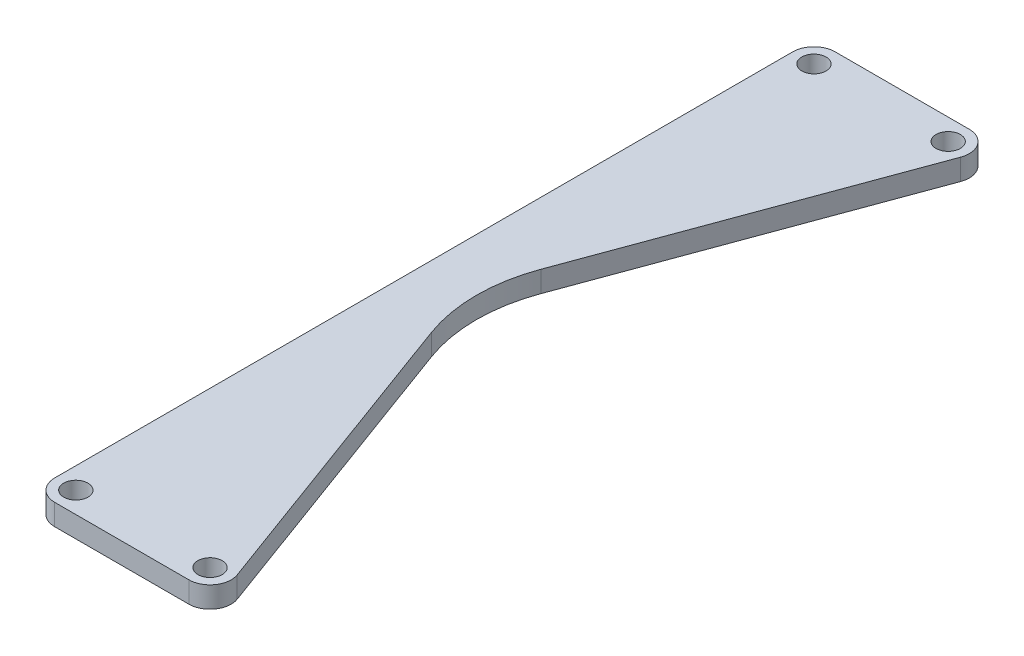
from build123d import *

# Parameters (mm, degrees)
SKETCH1_R           = 2.3
BOSS_EXTRUDE2_DEPTH = 4
FILLET1_R           = 4
FILLET2_R           = 30


with BuildPart() as part:
    # Sketch1 → Boss-Extrude2 (new body)
    with BuildSketch(Plane(origin=(0, 0, 0), x_dir=(1, 0, 0), z_dir=(0, 1, 0))):
        with BuildLine():
            Line((-4, -143.7), (-4, 4))
            Line((-4, 4), (25.4, 4))
            ThreePointArc((25.4, 4), (28.6800532, 2.289377864), (29.154640594, -1.379374498))
            Line((29.154640594, -1.379374498), (4, -69.85))
            Line((4, -69.85), (29.154640594, -138.320625502))
            ThreePointArc((29.154640594, -138.320625502), (28.6800532, -141.989377864), (25.4, -143.7))
            Line((25.4, -143.7), (-4, -143.7))
        make_face()
        with Locations(Location((0, 0, 0), (0, 0, 270))):
            Circle(SKETCH1_R, mode=Mode.SUBTRACT)
        with Locations(Location((25.4, 0, 0), (0, 0, 270))):
            Circle(SKETCH1_R, mode=Mode.SUBTRACT)
        with Locations(Location((25.4, -139.7, 0), (0, 0, 270))):
            Circle(SKETCH1_R, mode=Mode.SUBTRACT)
        with Locations(Location((0, -139.7, 0), (0, 0, 270))):
            Circle(SKETCH1_R, mode=Mode.SUBTRACT)
    extrude(amount=BOSS_EXTRUDE2_DEPTH)

    # Fillet1
    fillet1_edges = [part.edges().sort_by_distance(p)[0] for p in [
        (-4, 2, 143.7),
        (-4, 2, -4),
    ]]
    fillet(fillet1_edges, radius=FILLET1_R)

    # Fillet2
    fillet2_edges = [part.edges().sort_by_distance(p)[0] for p in [
        (4, 2, 69.85),
    ]]
    fillet(fillet2_edges, radius=FILLET2_R)


solid = part.part
